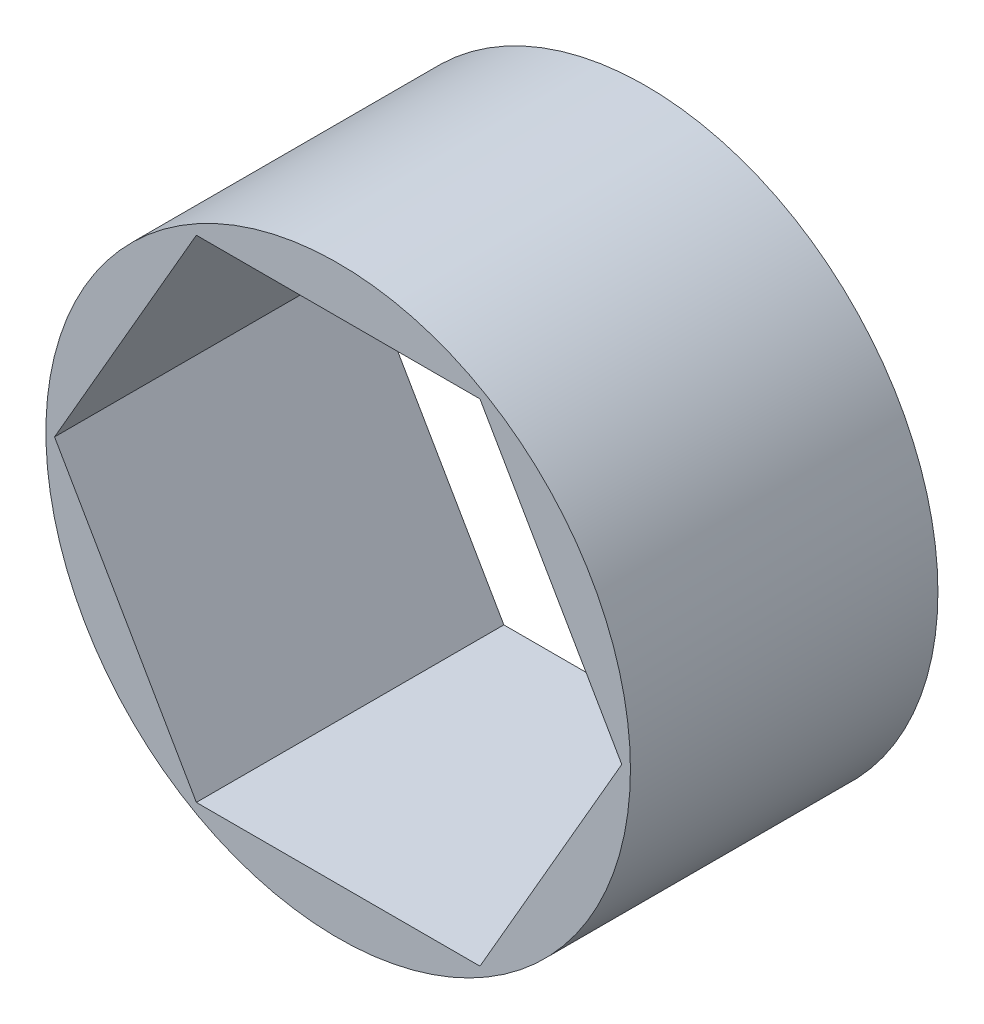
from build123d import *

# Parameters (mm, degrees)
SKETCH1_R           = 7.5565
BOSS_EXTRUDE1_DEPTH = 7.9502
CUT_EXTRUDE1_DEPTH  = 14.319424332


with BuildPart() as part:
    # Sketch1 → Boss-Extrude1 (new body)
    with BuildSketch(Plane.XY):
        Circle(SKETCH1_R)
    extrude(amount=BOSS_EXTRUDE1_DEPTH)

    # Sketch2 → Cut-Extrude1 (cut, through all)
    with BuildSketch(Plane.XY.offset(7.9502)):
        Polygon((7.332348419, 0), (3.666174209, 6.35), (-3.666174209, 6.35), (-7.332348419, 0), (-3.666174209, -6.35), (3.666174209, -6.35), align=None)
    extrude(amount=-CUT_EXTRUDE1_DEPTH, mode=Mode.SUBTRACT)


solid = part.part
